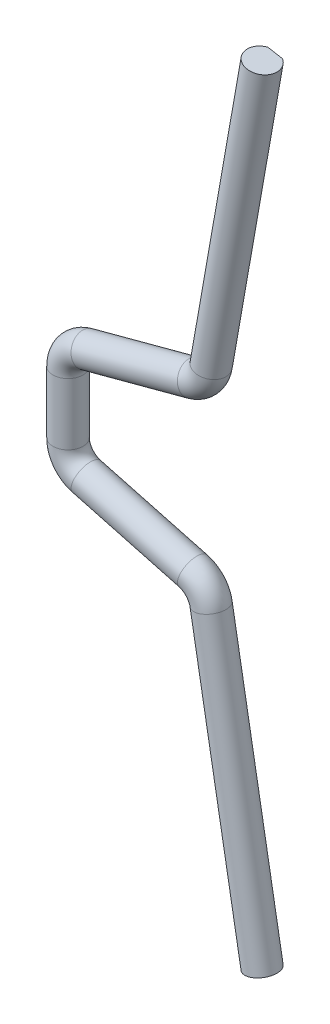
from build123d import *

# Parameters (mm, degrees)
SKETCH_2_R               = 0.75
CUT_EXTRUDE_1_DEPTH      = 23.321950206
CUT_EXTRUDE_1_DEPTH_BACK = 23.321950206
SKETCH_3_W               = 12
SKETCH_3_H               = 0.1
CUT_EXTRUDE_2_DEPTH      = 23.321950206
CUT_EXTRUDE_2_DEPTH_BACK = 23.321950206
SKETCH_4_W               = 0.1
SKETCH_4_H               = 1.5


with BuildPart() as part:
    # По траектории1: sweep along a path in Эскиз1
    with BuildLine(Plane.XY) as sweep_1_path:
        Line((9.683583031, 19.595), (7.138282612, 5.159884012))
        ThreePointArc((7.138282612, 5.159884012), (6.828869592, 4.532456475), (6.230796727, 4.169536951))
        Line((6.230796727, 4.169536951), (0.926476194, 2.748248548))
        ThreePointArc((0.926476194, 2.748248548), (0.258308325, 2.301793051), (0, 1.540841265))
        Line((0, 1.540841265), (0, -1.540841265))
        ThreePointArc((0, -1.540841265), (0.258308325, -2.301793051), (0.926476194, -2.748248548))
        Line((0.926476194, -2.748248548), (6.230796727, -4.169536951))
        ThreePointArc((6.230796727, -4.169536951), (6.828869592, -4.532456475), (7.138282612, -5.159884012))
        Line((7.138282612, -5.159884012), (9.683583031, -19.595))
    # Эскиз2 → По траектории1 (sweep)
    with BuildSketch(Plane(origin=(0, 0, 0), x_dir=(1, 0, 0), z_dir=(0, 1, 0))):
        Circle(SKETCH_2_R)
    sweep(path=sweep_1_path.line)

    # Эскиз3 → Вырез-Вытянуть1 (cut, two sides: drawn at the far end of the back side and taken through both)
    with BuildSketch(Plane(origin=(0, 0, 0), x_dir=(1, 0, 0), z_dir=(0, 1, 0)).offset(-CUT_EXTRUDE_1_DEPTH_BACK)):
        with Locations((5, 0.7)):
            Rectangle(SKETCH_3_W, SKETCH_3_H)
    extrude(amount=CUT_EXTRUDE_1_DEPTH + CUT_EXTRUDE_1_DEPTH_BACK, mode=Mode.SUBTRACT)

    # Эскиз4 → Вырез-Вытянуть2 (cut, two sides: drawn at the far end of the back side and taken through both)
    with BuildSketch(Plane(origin=(0, 0, 0), x_dir=(1, 0, 0), z_dir=(0, 1, 0)).offset(-CUT_EXTRUDE_2_DEPTH_BACK)):
        with Locations((-0.7, 0)):
            Rectangle(SKETCH_4_W, SKETCH_4_H)
    extrude(amount=CUT_EXTRUDE_2_DEPTH + CUT_EXTRUDE_2_DEPTH_BACK, mode=Mode.SUBTRACT)


solid = part.part
